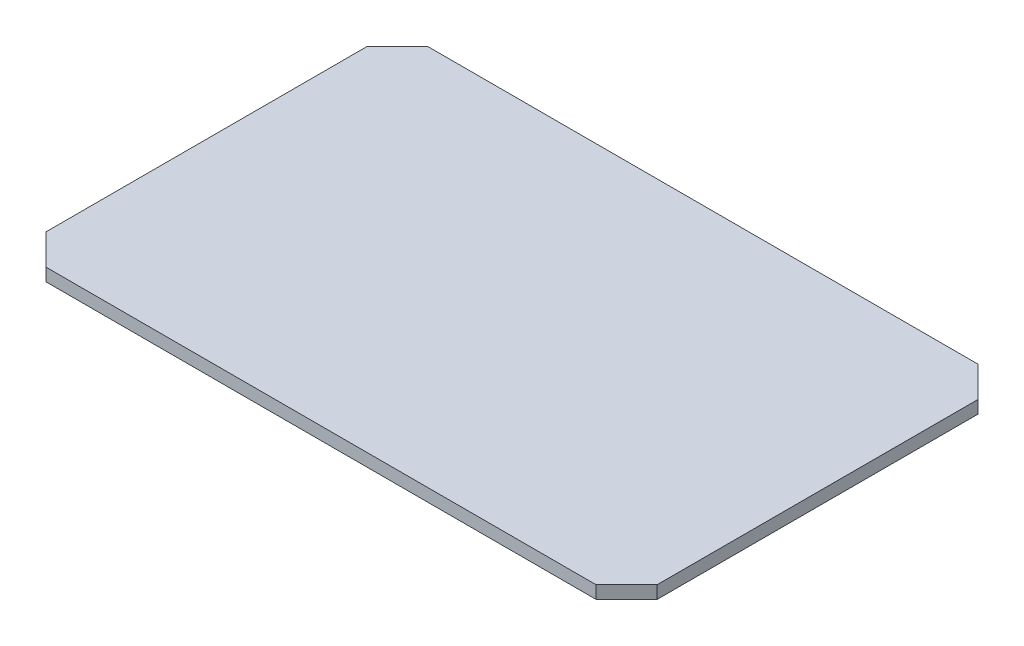
from build123d import *

# Parameters (mm, degrees)
ESBO_O1_W       = 4.8
ESBO_O1_H       = 3
EXTRUS_O1_DEPTH = 0.1
CHANFRO1_SIZE   = 0.24
CHANFRO2_SIZE   = 0.24
CHANFRO3_SIZE   = 0.24
CHANFRO4_SIZE   = 0.24


with BuildPart() as part:
    # Esboço1 → Extrusão1 (new body)
    with BuildSketch(Plane(origin=(0, 0, 0), x_dir=(1, 0, 0), z_dir=(0, 1, 0))):
        Rectangle(ESBO_O1_W, ESBO_O1_H)
    extrude(amount=EXTRUS_O1_DEPTH)

    # Chanfro1
    chanfro1_edges = [part.edges().sort_by_distance(p)[0] for p in [
        (2.4, 0.05, 1.5),
    ]]
    chamfer(chanfro1_edges, length=CHANFRO1_SIZE)

    # Chanfro2
    chanfro2_edges = [part.edges().sort_by_distance(p)[0] for p in [
        (-2.4, 0.05, 1.5),
    ]]
    chamfer(chanfro2_edges, length=CHANFRO2_SIZE)

    # Chanfro3
    chanfro3_edges = [part.edges().sort_by_distance(p)[0] for p in [
        (2.4, 0.05, -1.5),
    ]]
    chamfer(chanfro3_edges, length=CHANFRO3_SIZE)

    # Chanfro4
    chanfro4_edges = [part.edges().sort_by_distance(p)[0] for p in [
        (-2.4, 0.05, -1.5),
    ]]
    chamfer(chanfro4_edges, length=CHANFRO4_SIZE)


solid = part.part
